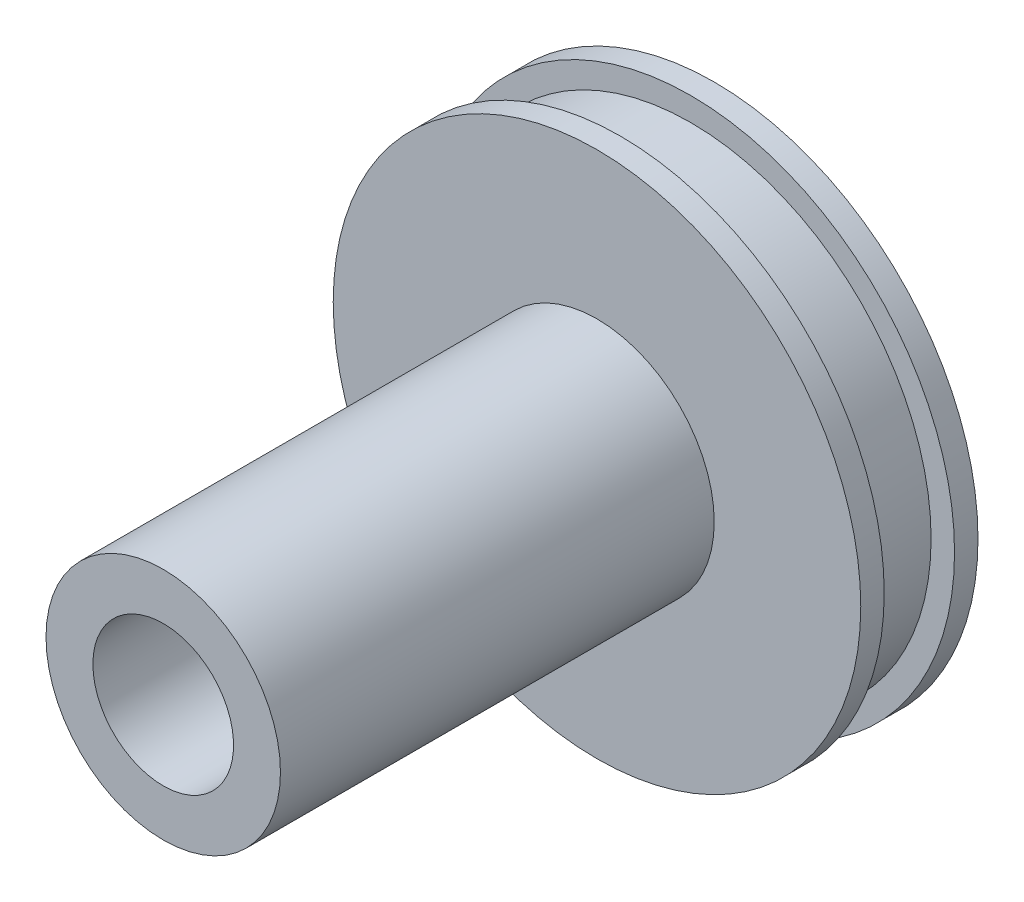
from build123d import *

# Parameters (mm, degrees)
SKIZZE1_R                        = 22.5
SEITE1_DEPTH                     = 2
SKIZZE2_R                        = 20.5
LAUFFL_CHE_DEPTH                 = 8
SKIZZE5_R                        = 22.5
SEITE_2_DEPTH                    = 2
BOHRUNG_DEPTH                    = 100
BOHRUNG_DEPTH_BACK               = 34.35416016
SKIZZE7_R                        = 2.5
SKIZZE9_R                        = 10
ZAPFEN_DEPTH                     = 37
F_12_0_12_DURCHMESSER_BOHRUNG1_D = 12


with BuildPart() as part:
    # Skizze1 → Seite1 (new body)
    with BuildSketch(Plane.XY):
        Circle(SKIZZE1_R)
    extrude(amount=SEITE1_DEPTH)

    # Skizze2 → Lauffläche (add)
    with BuildSketch(Plane.XY):
        Circle(SKIZZE2_R)
    extrude(amount=LAUFFL_CHE_DEPTH)

    # Skizze5 → Seite 2 (add)
    with BuildSketch(Plane.XY.offset(8)):
        Circle(SKIZZE5_R)
    extrude(amount=SEITE_2_DEPTH)

    # Skizze7 → Bohrung (cut, two sides: drawn at the far end of the back side and taken through both)
    with BuildSketch(Plane.XY.offset(-BOHRUNG_DEPTH_BACK)):
        Circle(SKIZZE7_R)
    extrude(amount=BOHRUNG_DEPTH + BOHRUNG_DEPTH_BACK, mode=Mode.SUBTRACT)

    # Skizze9 → Zapfen (add)
    with BuildSketch(Plane.XY.offset(10)):
        Circle(SKIZZE9_R)
    extrude(amount=ZAPFEN_DEPTH)

    # Ø12.0 (12) Durchmesser Bohrung1 (through all)
    with Locations(Plane(origin=(0, 0, 0), x_dir=(-1, 0, 0), z_dir=(0, 0, -1))):
        with Locations((0, 0)):
            Hole(F_12_0_12_DURCHMESSER_BOHRUNG1_D / 2)


solid = part.part
